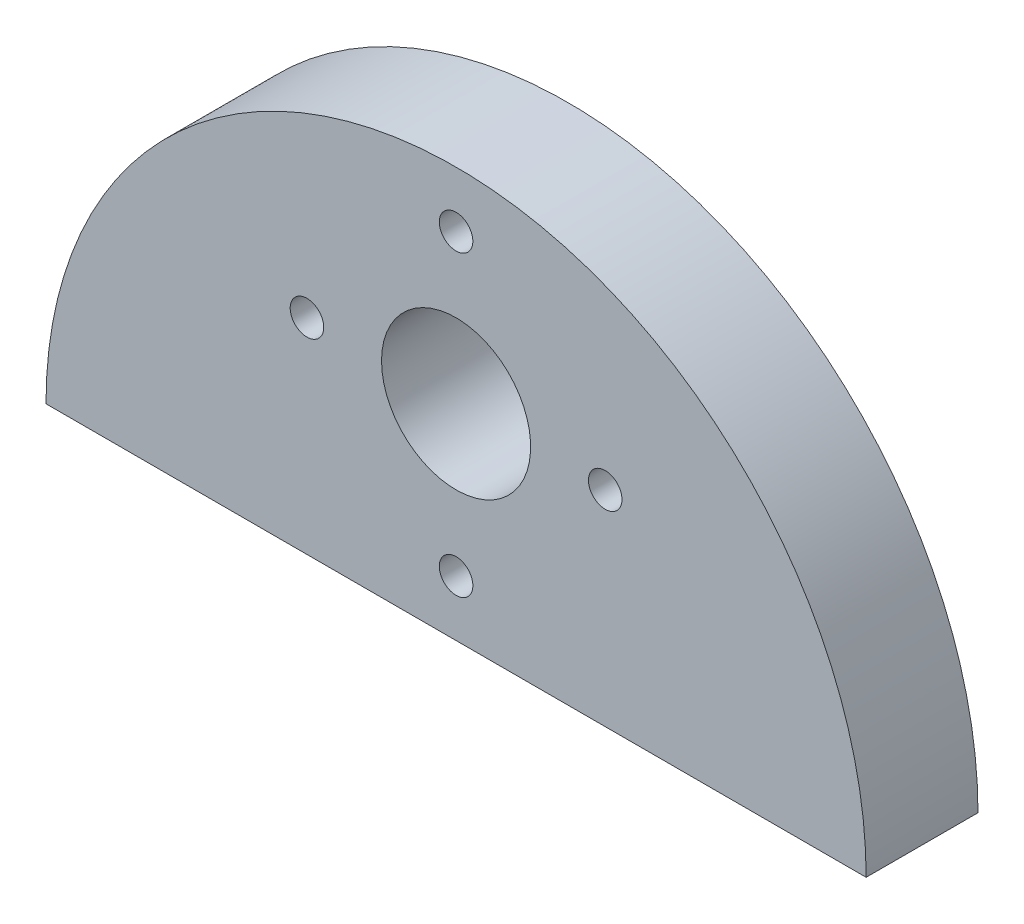
from build123d import *

# Parameters (mm, degrees)
BOSS_EXTRU_2_DEPTH      = 6
ESQUISSE4_R             = 4
ESQUISSE4_R_2           = 0.9
ENL_V_MAT_EXTRU_1_DEPTH = 6


with BuildPart() as part:
    # Esquisse2 → Boss.-Extru.2 (new body)
    with BuildSketch(Plane.XY):
        with BuildLine():
            Line((-22, 0), (22, 0))
            ThreePointArc((22, 0), (0, 22), (-22, 0))
        make_face()
    extrude(amount=BOSS_EXTRU_2_DEPTH)

    # Esquisse4 → Enlèv. mat.-Extru.1 (cut)
    with BuildSketch(Plane(origin=(0, 0, 0), x_dir=(-1, 0, 0), z_dir=(0, 0, -1))):
        with Locations((0, 11)):
            Circle(ESQUISSE4_R)
        with Locations((0, 19)):
            Circle(ESQUISSE4_R_2)
        with Locations((0, 3)):
            Circle(ESQUISSE4_R_2)
        with Locations((-8, 11)):
            Circle(ESQUISSE4_R_2)
        with Locations(Location((8, 11, 0), (0, 0, 180))):
            Circle(ESQUISSE4_R_2)
    extrude(amount=-ENL_V_MAT_EXTRU_1_DEPTH, mode=Mode.SUBTRACT)


solid = part.part
